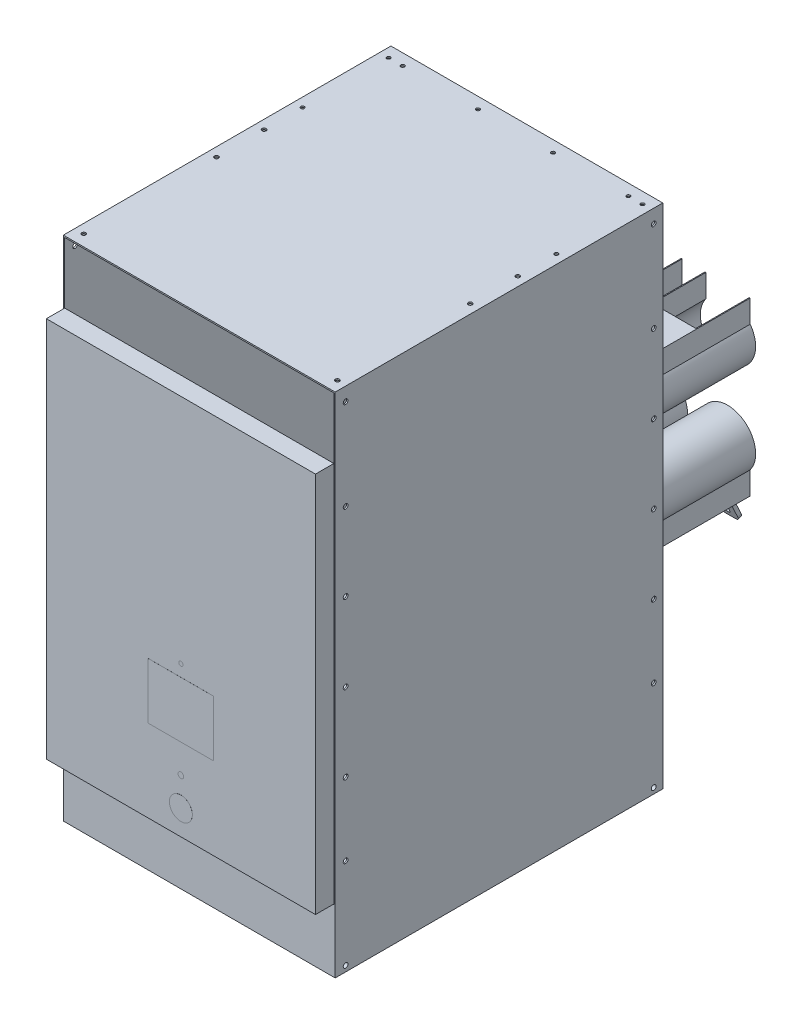
from build123d import *

# Parameters (mm, degrees)
CROQUIS1_W              = 600
CROQUIS1_H              = 1120
SALIENTE_EXTRUIR1_DEPTH = 723
VACIADO1_T              = -3
CROQUIS2_W              = 600
CROQUIS2_H              = 139
SALIENTE_EXTRUIR2_DEPTH = 720
CROQUIS3_W              = 594
CROQUIS3_H              = 1
SALIENTE_EXTRUIR3_DEPTH = 1
CROQUIS4_W              = 594
CROQUIS4_H              = 842
SALIENTE_EXTRUIR4_DEPTH = 40.5
CROQUIS5_R              = 8
CORTAR_EXTRUIR1_DEPTH   = 2
SALIENTE_EXTRUIR5_DEPTH = 293
CROQUIS8_R              = 8
SALIENTE_EXTRUIR7_DEPTH = 177
CROQUIS9_W              = 96
CROQUIS9_H              = 116
CROQUIS9_H_2            = 2
CORTAR_EXTRUIR4_DEPTH   = 2
CROQUIS10_R             = 20.5
CROQUIS10_R_2           = 8
SALIENTE_EXTRUIR8_DEPTH = 2
CROQUIS12_W             = 40
CROQUIS12_H             = 8
REDONDEO1_R             = 10
MATRIZL1_COUNT          = 3
MATRIZL1_PITCH          = 150
REDONDEO1_OF_MATRIZL1_R = 10
CROQUIS13_W             = 513.925847713
CROQUIS13_H             = 131.900208182
CORTAR_EXTRUIR5_DEPTH   = 66
CROQUIS14_R             = 4.713676521
CROQUIS14_R_2           = 6.159256553
CROQUIS14_R_3           = 25.295091501
CROQUIS14_W             = 144.583684526
CROQUIS14_H             = 123.656445171
SALIENTE_EXTRUIR9_DEPTH = 0.1
CROQUIS18_R             = 4
CROQUIS18_R_2           = 5.25
CORTAR_EXTRUIR8_DEPTH   = 57
CROQUIS19_R             = 4
CROQUIS19_R_2           = 4.5
CORTAR_EXTRUIR9_DEPTH   = 16
CROQUIS20_R             = 5.25
CORTAR_EXTRUIR10_DEPTH  = 16
CORTAR_EXTRUIR11_START  = -16
CROQUIS21_R             = 5.25
CORTAR_EXTRUIR11_DEPTH  = 16
CORTAR_EXTRUIR12_DEPTH  = 42
MATRIZL2_COUNT          = 2
MATRIZL2_PITCH          = 30


with BuildPart() as part:
    # Croquis1 → Saliente-Extruir1 (new body)
    with BuildSketch(Plane.XY):
        Rectangle(CROQUIS1_W, CROQUIS1_H)
    extrude(amount=-SALIENTE_EXTRUIR1_DEPTH)

    # Vaciado1
    vaciado1_openings = [part.faces().sort_by_distance(p)[0] for p in [
        (0, 0, 0),
    ]]
    offset(amount=VACIADO1_T, openings=vaciado1_openings, kind=Kind.INTERSECTION)

    # Croquis2 → Saliente-Extruir2 (add)
    with BuildSketch(Plane.XY):
        with Locations((0, -490.5)):
            Rectangle(CROQUIS2_W, CROQUIS2_H)
    extrude(amount=-SALIENTE_EXTRUIR2_DEPTH)

    # Croquis5 → Cortar-Extruir1 (cut)
    with BuildSketch(Plane(origin=(0, 0, -723), x_dir=(-1, 0, 0), z_dir=(0, 0, -1))):
        with Locations((-150, 95)):
            Circle(CROQUIS5_R)
        with Locations((0, 95)):
            Circle(CROQUIS5_R)
        with Locations((150, 95)):
            Circle(CROQUIS5_R)
        with Locations(Location((150, -110, 0), (0, 0, 180))):
            Circle(CROQUIS5_R)
        with Locations(Location((0, -110, 0), (0, 0, 180))):
            Circle(CROQUIS5_R)
        with Locations(Location((-150, -110, 0), (0, 0, 180))):
            Circle(CROQUIS5_R)
    extrude(amount=-CORTAR_EXTRUIR1_DEPTH, mode=Mode.SUBTRACT)

    # Croquis7 → Saliente-Extruir5 (add)
    # profile 1 of 3: a face of its own
    with BuildSketch(Plane(origin=(0, 0, -723), x_dir=(-1, 0, 0), z_dir=(0, 0, -1))):
        with BuildLine():
            Line((100, 131.66060556), (100, 181.66060556))
            Line((100, 181.66060556), (200, 181.66060556))
            Line((200, 181.66060556), (200, 131.66060556))
            ThreePointArc((200, 131.66060556), (150, 33), (100, 131.66060556))
        make_face()
        with BuildLine():
            Line((198, 131), (198, 179.66060556))
            Line((198, 179.66060556), (102, 179.66060556))
            Line((102, 179.66060556), (102, 131))
            ThreePointArc((102, 131), (150, 35), (198, 131))
        make_face(mode=Mode.SUBTRACT)
    # profile 2 of 3: a face of its own
    with BuildSketch(Plane(origin=(0, 0, -723), x_dir=(-1, 0, 0), z_dir=(0, 0, -1))):
        with BuildLine():
            Line((-50, 131.66060556), (-50, 181.66060556))
            Line((-50, 181.66060556), (50, 181.66060556))
            Line((50, 181.66060556), (50, 131.66060556))
            ThreePointArc((50, 131.66060556), (0, 33), (-50, 131.66060556))
        make_face()
        with BuildLine():
            Line((48, 179.66060556), (-48, 179.66060556))
            Line((-48, 179.66060556), (-48, 131))
            ThreePointArc((-48, 131), (0, 35), (48, 131))
            Line((48, 131), (48, 179.66060556))
        make_face(mode=Mode.SUBTRACT)
    # profile 3 of 3: a face of its own
    with BuildSketch(Plane(origin=(0, 0, -723), x_dir=(-1, 0, 0), z_dir=(0, 0, -1))):
        with BuildLine():
            Line((-200, 131.66060556), (-200, 181.66060556))
            Line((-200, 181.66060556), (-100, 181.66060556))
            Line((-100, 181.66060556), (-100, 131.66060556))
            ThreePointArc((-100, 131.66060556), (-150, 33), (-200, 131.66060556))
        make_face()
        with BuildLine():
            Line((-102, 179.66060556), (-198, 179.66060556))
            Line((-198, 179.66060556), (-198, 131))
            ThreePointArc((-198, 131), (-150, 35), (-102, 131))
            Line((-102, 131), (-102, 179.66060556))
        make_face(mode=Mode.SUBTRACT)
    saliente_extruir5 = extrude(amount=SALIENTE_EXTRUIR5_DEPTH)

    # Croquis8 → Saliente-Extruir7 (add)
    # profile 1 of 3: a face of its own
    with BuildSketch(Plane(origin=(0, 0, -723), x_dir=(-1, 0, 0), z_dir=(0, 0, -1))):
        with BuildLine():
            Line((102, 179.66060556), (102, 131))
            ThreePointArc((102, 131), (150, 35), (198, 131))
            Line((198, 131), (198, 179.66060556))
            Line((198, 179.66060556), (102, 179.66060556))
        make_face()
        with Locations((150, 95)):
            Circle(CROQUIS8_R, mode=Mode.SUBTRACT)
    # profile 2 of 3: a face of its own
    with BuildSketch(Plane(origin=(0, 0, -723), x_dir=(-1, 0, 0), z_dir=(0, 0, -1))):
        with BuildLine():
            Line((-48, 179.66060556), (-48, 131))
            ThreePointArc((-48, 131), (0, 35), (48, 131))
            Line((48, 131), (48, 179.66060556))
            Line((48, 179.66060556), (-48, 179.66060556))
        make_face()
        with Locations((0, 95)):
            Circle(CROQUIS8_R, mode=Mode.SUBTRACT)
    # profile 3 of 3: a face of its own
    with BuildSketch(Plane(origin=(0, 0, -723), x_dir=(-1, 0, 0), z_dir=(0, 0, -1))):
        with BuildLine():
            Line((-198, 179.66060556), (-198, 131))
            ThreePointArc((-198, 131), (-150, 35), (-102, 131))
            Line((-102, 131), (-102, 179.66060556))
            Line((-102, 179.66060556), (-198, 179.66060556))
        make_face()
        with Locations((-150, 95)):
            Circle(CROQUIS8_R, mode=Mode.SUBTRACT)
    saliente_extruir7 = extrude(amount=SALIENTE_EXTRUIR7_DEPTH)

    # Croquis9 → Cortar-Extruir4 (cut)
    with BuildSketch(Plane(origin=(0, 181.66060556, 0), x_dir=(1, 0, 0), z_dir=(0, 1, 0))):
        with Locations((-150, 956)):
            Rectangle(CROQUIS9_W, CROQUIS9_H)
        with Locations((0, 956)):
            Rectangle(CROQUIS9_W, CROQUIS9_H)
        with Locations((150, 956)):
            Rectangle(CROQUIS9_W, CROQUIS9_H)
        with Locations((-150, 1015)):
            Rectangle(CROQUIS9_W, CROQUIS9_H_2)
        with Locations((0, 1015)):
            Rectangle(CROQUIS9_W, CROQUIS9_H_2)
        with Locations((150, 1015)):
            Rectangle(CROQUIS9_W, CROQUIS9_H_2)
    cortar_extruir4 = extrude(amount=-CORTAR_EXTRUIR4_DEPTH, mode=Mode.SUBTRACT)

    # Croquis10 → Saliente-Extruir8 (add)
    # profile 1 of 3: a face of its own
    with BuildSketch(Plane(origin=(0, 0, -900), x_dir=(-1, 0, 0), z_dir=(0, 0, -1))):
        with Locations((-150, 95)):
            Circle(CROQUIS10_R)
        with Locations((-150, 95)):
            Circle(CROQUIS10_R_2, mode=Mode.SUBTRACT)
    # profile 2 of 3: a face of its own
    with BuildSketch(Plane(origin=(0, 0, -900), x_dir=(-1, 0, 0), z_dir=(0, 0, -1))):
        with Locations((0, 95)):
            Circle(CROQUIS10_R)
        with Locations((0, 95)):
            Circle(CROQUIS10_R_2, mode=Mode.SUBTRACT)
    # profile 3 of 3: a face of its own
    with BuildSketch(Plane(origin=(0, 0, -900), x_dir=(-1, 0, 0), z_dir=(0, 0, -1))):
        with Locations((150, 95)):
            Circle(CROQUIS10_R)
        with Locations((150, 95)):
            Circle(CROQUIS10_R_2, mode=Mode.SUBTRACT)
    saliente_extruir8 = extrude(amount=SALIENTE_EXTRUIR8_DEPTH)

    # Simetría1: Saliente-Extruir5, Saliente-Extruir7, Cortar-Extruir4, Saliente-Extruir8 across plane
    add(saliente_extruir5.mirror(Plane(origin=(0, -7.5, 0), x_dir=(0, 0, 1), z_dir=(0, -1, 0))))
    add(saliente_extruir7.mirror(Plane(origin=(0, -7.5, 0), x_dir=(0, 0, 1), z_dir=(0, -1, 0))))
    add(cortar_extruir4.mirror(Plane(origin=(0, -7.5, 0), x_dir=(0, 0, 1), z_dir=(0, -1, 0))), mode=Mode.SUBTRACT)
    add(saliente_extruir8.mirror(Plane(origin=(0, -7.5, 0), x_dir=(0, 0, 1), z_dir=(0, -1, 0))))

    # Barrer1: sweep along a curve in space
    with BuildLine() as barrer1_path:
        Line((-150, -164, -900), (-150, -164, -974.820381784))
        ThreePointArc((-150, -164, -974.820381784), (-150, -165.561174161, -980.185660757), (-150, -169.757243693, -983.875712751))
        Line((-150, -169.757243693, -983.875712751), (-150, -261.797574444, -1027))
    # Croquis12 → Barrer1 (sweep)
    with BuildSketch(Plane(origin=(0, 0, -900), x_dir=(-1, 0, 0), z_dir=(0, 0, -1))):
        with Locations((150, -164)):
            Rectangle(CROQUIS12_W, CROQUIS12_H)
    barrer1 = sweep(path=barrer1_path.line)

    # Redondeo1
    redondeo1_edges = [part.edges().sort_by_distance(p)[0] for p in [
        (-170, -261.797574444, -1027),
        (-130, -261.797574444, -1027),
    ]]
    fillet(redondeo1_edges, radius=REDONDEO1_R)

    # MatrizL1: Barrer1 ×3
    with Locations(*[(i * MATRIZL1_PITCH, 0, 0) for i in range(1, MATRIZL1_COUNT)]):
        add(barrer1)

    # Redondeo1 of MatrizL1
    redondeo1_of_matrizl1_edges = [part.edges().sort_by_distance(p)[0] for p in [
        (-20, -261.797574444, -1027),
        (20, -261.797574444, -1027),
        (130, -261.797574444, -1027),
        (170, -261.797574444, -1027),
    ]]
    fillet(redondeo1_of_matrizl1_edges, radius=REDONDEO1_OF_MATRIZL1_R)

    # Croquis13 → Cortar-Extruir5 (cut)
    with BuildSketch(Plane(origin=(0, 0, -723), x_dir=(-1, 0, 0), z_dir=(0, 0, -1))):
        with Locations((-8.361324778, -352.310993281)):
            Rectangle(CROQUIS13_W, CROQUIS13_H)
    extrude(amount=-CORTAR_EXTRUIR5_DEPTH, mode=Mode.SUBTRACT)

    # Croquis18 → Cortar-Extruir8 (cut)
    with BuildSketch(Plane.XZ.offset(560)):
        with Locations(Location((-280, -500.5, 0), (0, 0, 270))):
            Circle(CROQUIS18_R)
        with Locations(Location((-280, -318, 0), (0, 0, 270))):
            Circle(CROQUIS18_R)
        with Locations(Location((-280, -40, 0), (0, 0, 270))):
            Circle(CROQUIS18_R)
        with Locations(Location((-280, -683, 0), (0, 0, 270))):
            Circle(CROQUIS18_R)
        with Locations(Location((280, -683, 0), (0, 0, 90))):
            Circle(CROQUIS18_R)
        with Locations(Location((280, -40, 0), (0, 0, 90))):
            Circle(CROQUIS18_R)
        with Locations(Location((280, -318, 0), (0, 0, 90))):
            Circle(CROQUIS18_R)
        with Locations(Location((280, -500.5, 0), (0, 0, 90))):
            Circle(CROQUIS18_R)
        with Locations(Location((235, -25, 0), (0, 0, 270))):
            Circle(CROQUIS18_R_2)
        with Locations(Location((83, -25, 0), (0, 0, 270))):
            Circle(CROQUIS18_R_2)
        with Locations(Location((-83, -25, 0), (0, 0, 270))):
            Circle(CROQUIS18_R_2)
        with Locations(Location((-235, -25, 0), (0, 0, 270))):
            Circle(CROQUIS18_R_2)
    extrude(amount=-CORTAR_EXTRUIR8_DEPTH, mode=Mode.SUBTRACT)

    # Croquis19 → Cortar-Extruir9 (cut)
    with BuildSketch(Plane(origin=(0, 560, 0), x_dir=(1, 0, 0), z_dir=(0, 1, 0))):
        with Locations(Location((280, 698, 0), (0, 0, 270))):
            Circle(CROQUIS19_R)
        with Locations(Location((280, 508, 0), (0, 0, 270))):
            Circle(CROQUIS19_R)
        with Locations(Location((280, 318, 0), (0, 0, 270))):
            Circle(CROQUIS19_R_2)
        with Locations(Location((280, 25, 0), (0, 0, 270))):
            Circle(CROQUIS19_R_2)
        with Locations(Location((280, 423, 0), (0, 0, 270))):
            Circle(CROQUIS19_R_2)
        with Locations(Location((83, 698, 0), (0, 0, 270))):
            Circle(CROQUIS19_R)
        with Locations(Location((-280, 698, 0), (0, 0, 270))):
            Circle(CROQUIS19_R)
        with Locations(Location((249, 698, 0), (0, 0, 270))):
            Circle(CROQUIS19_R)
        with Locations(Location((-83, 698, 0), (0, 0, 270))):
            Circle(CROQUIS19_R)
        with Locations(Location((-249, 698, 0), (0, 0, 270))):
            Circle(CROQUIS19_R)
        with Locations(Location((-280, 508, 0), (0, 0, 270))):
            Circle(CROQUIS19_R)
        with Locations(Location((-280, 423, 0), (0, 0, 270))):
            Circle(CROQUIS19_R_2)
        with Locations(Location((-280, 318, 0), (0, 0, 270))):
            Circle(CROQUIS19_R_2)
        with Locations(Location((-280, 25, 0), (0, 0, 270))):
            Circle(CROQUIS19_R_2)
    extrude(amount=-CORTAR_EXTRUIR9_DEPTH, mode=Mode.SUBTRACT)

    # Croquis20 → Cortar-Extruir10 (cut)
    with BuildSketch(Plane.ZY.offset(300)):
        with Locations(Location((-703, -547.5, 0), (0, 0, 270))):
            Circle(CROQUIS20_R)
        with Locations(Location((-703, -347.5, 0), (0, 0, 270))):
            Circle(CROQUIS20_R)
        with Locations(Location((-703, -187.5, 0), (0, 0, 270))):
            Circle(CROQUIS20_R)
        with Locations(Location((-703, 157.5, 0), (0, 0, 270))):
            Circle(CROQUIS20_R)
        with Locations(Location((-703, 330, 0), (0, 0, 270))):
            Circle(CROQUIS20_R)
        with Locations(Location((-703, 530, 0), (0, 0, 270))):
            Circle(CROQUIS20_R)
        with Locations(Location((-703, -15, 0), (0, 0, 270))):
            Circle(CROQUIS20_R)
        with Locations(Location((-23, -15, 0), (0, 0, 270))):
            Circle(CROQUIS20_R)
        with Locations(Location((-23, 530, 0), (0, 0, 270))):
            Circle(CROQUIS20_R)
        with Locations(Location((-23, 330, 0), (0, 0, 270))):
            Circle(CROQUIS20_R)
        with Locations(Location((-23, 157.5, 0), (0, 0, 270))):
            Circle(CROQUIS20_R)
        with Locations(Location((-23, -187.5, 0), (0, 0, 270))):
            Circle(CROQUIS20_R)
        with Locations(Location((-23, -347.5, 0), (0, 0, 270))):
            Circle(CROQUIS20_R)
        with Locations(Location((-23, -547.5, 0), (0, 0, 90))):
            Circle(CROQUIS20_R)
    extrude(amount=-CORTAR_EXTRUIR10_DEPTH, mode=Mode.SUBTRACT)

    # Croquis21 → Cortar-Extruir11 (cut)
    with BuildSketch(Plane(origin=(300, 0, 0), x_dir=(0, 0, -1), z_dir=(1, 0, 0)).offset(CORTAR_EXTRUIR11_START)):
        with Locations(Location((23, 530, 0), (0, 0, 270))):
            Circle(CROQUIS21_R)
        with Locations(Location((23, 330, 0), (0, 0, 270))):
            Circle(CROQUIS21_R)
        with Locations(Location((23, 157.5, 0), (0, 0, 270))):
            Circle(CROQUIS21_R)
        with Locations(Location((23, -15, 0), (0, 0, 270))):
            Circle(CROQUIS21_R)
        with Locations(Location((23, -187.5, 0), (0, 0, 270))):
            Circle(CROQUIS21_R)
        with Locations(Location((23, -347.5, 0), (0, 0, 270))):
            Circle(CROQUIS21_R)
        with Locations(Location((23, -547.5, 0), (0, 0, 90))):
            Circle(CROQUIS21_R)
        with Locations(Location((703, -547.5, 0), (0, 0, 270))):
            Circle(CROQUIS21_R)
        with Locations(Location((703, -347.5, 0), (0, 0, 270))):
            Circle(CROQUIS21_R)
        with Locations(Location((703, -187.5, 0), (0, 0, 270))):
            Circle(CROQUIS21_R)
        with Locations(Location((703, -15, 0), (0, 0, 270))):
            Circle(CROQUIS21_R)
        with Locations(Location((703, 157.5, 0), (0, 0, 270))):
            Circle(CROQUIS21_R)
        with Locations(Location((703, 330, 0), (0, 0, 270))):
            Circle(CROQUIS21_R)
        with Locations(Location((703, 530, 0), (0, 0, 270))):
            Circle(CROQUIS21_R)
    extrude(amount=CORTAR_EXTRUIR11_DEPTH, mode=Mode.SUBTRACT)

    # Croquis22 → Cortar-Extruir12 (cut)
    with BuildSketch(Plane(origin=(0, 349.139878272, -745.170573798), x_dir=(-1, 0, 0), z_dir=(0, 0.4242756306682034, -0.905533096701108))):
        with BuildLine():
            Line((145, -656.797440991), (145, -647.797440991))
            ThreePointArc((145, -647.797440991), (150, -642.797440991), (155, -647.797440991))
            Line((155, -647.797440991), (155, -656.797440991))
            ThreePointArc((155, -656.797440991), (150, -661.797440991), (145, -656.797440991))
        make_face()
        with BuildLine():
            Line((-5, -656.797440991), (-5, -647.797440991))
            ThreePointArc((-5, -647.797440991), (0, -642.797440991), (5, -647.797440991))
            Line((5, -647.797440991), (5, -656.797440991))
            ThreePointArc((5, -656.797440991), (0, -661.797440991), (-5, -656.797440991))
        make_face()
        with BuildLine():
            Line((-155, -656.797440991), (-155, -647.797440991))
            ThreePointArc((-155, -647.797440991), (-150, -642.797440991), (-145, -647.797440991))
            Line((-145, -647.797440991), (-145, -656.797440991))
            ThreePointArc((-145, -656.797440991), (-150, -661.797440991), (-155, -656.797440991))
        make_face()
    cortar_extruir12 = extrude(amount=-CORTAR_EXTRUIR12_DEPTH, mode=Mode.SUBTRACT)

    # MatrizL2: Cortar-Extruir12 ×2
    with Locations(*[Vector(-1.8400268484559505e-15, 0.905533096701108, 0.4242756306682034) * (i * MATRIZL2_PITCH) for i in range(1, MATRIZL2_COUNT)]):
        add(cortar_extruir12, mode=Mode.SUBTRACT)


with BuildPart() as body_2:
    # Croquis3 → Saliente-Extruir3 (new body)
    with BuildSketch(Plane.XY):
        with Locations((0, -420.5)):
            Rectangle(CROQUIS3_W, CROQUIS3_H)
    extrude(amount=SALIENTE_EXTRUIR3_DEPTH)

    # Croquis4 → Saliente-Extruir4 (add)
    with BuildSketch(Plane.XY):
        with Locations((0, 1)):
            Rectangle(CROQUIS4_W, CROQUIS4_H)
    extrude(amount=SALIENTE_EXTRUIR4_DEPTH)

    # Croquis14 → Saliente-Extruir9 (add)
    with BuildSketch(Plane.XY.offset(40.5)):
        with Locations(Location((0, -88.801925227, 0), (0, 0, 180))):
            Circle(CROQUIS14_R)
        with Locations(Location((0, -302.095787802, 0), (0, 0, 180))):
            Circle(CROQUIS14_R_2)
        with Locations(Location((0, -365.309522716, 0), (0, 0, 180))):
            Circle(CROQUIS14_R_3)
        with Locations((0, -176.839269605)):
            Rectangle(CROQUIS14_W, CROQUIS14_H)
    extrude(amount=SALIENTE_EXTRUIR9_DEPTH)


solid = Compound([part.part, body_2.part])
